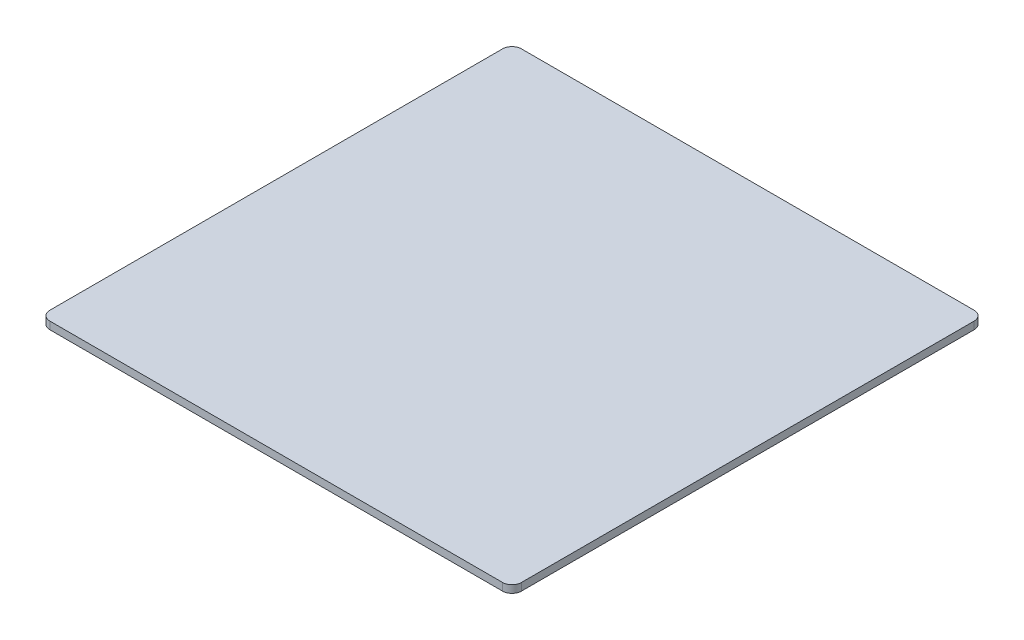
from build123d import *

# Parameters (mm, degrees)
SKETCH_1_W      = 100
SKETCH_1_H      = 100
EXTRUDE_1_DEPTH = 1.6
FILLET_1_R      = 2


with BuildPart() as part:
    # 草图1 → 凸台-拉伸1 (new body)
    with BuildSketch(Plane(origin=(0, 0, 0), x_dir=(1, 0, 0), z_dir=(0, 1, 0))):
        Rectangle(SKETCH_1_W, SKETCH_1_H)
    extrude(amount=EXTRUDE_1_DEPTH)

    # 圆角1
    fillet_1_edges = [part.edges().sort_by_distance(p)[0] for p in [
        (50, 0.8, 50),
        (-50, 0.8, 50),
        (-50, 0.8, -50),
        (50, 0.8, -50),
    ]]
    fillet(fillet_1_edges, radius=FILLET_1_R)


solid = part.part
